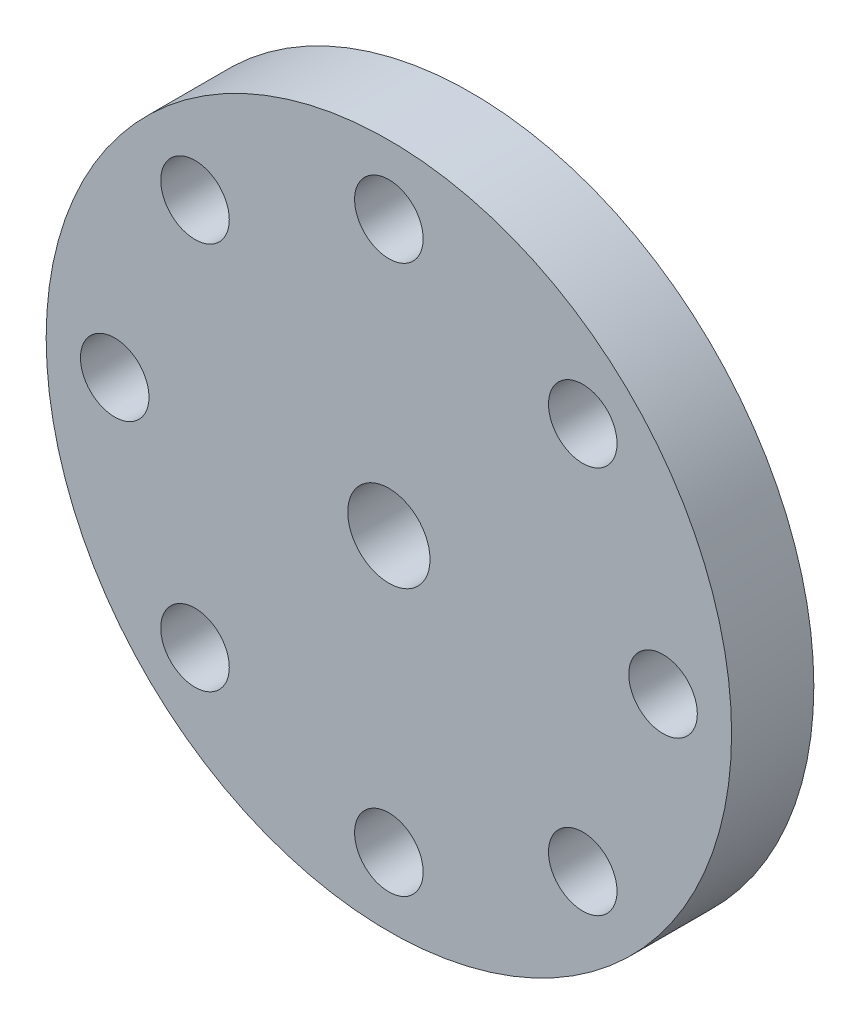
from build123d import *

# Parameters (mm, degrees)
SKETCH1_R           = 12.5
SKETCH1_R_2         = 1.25
SKETCH1_R_3         = 1.5
BOSS_EXTRUDE1_DEPTH = 3
SKETCH3_R           = 3.5
SKETCH3_R_2         = 1.5
CUT_EXTRUDE1_DEPTH  = 0.5


with BuildPart() as part:
    # Sketch1 → Boss-Extrude1 (new body)
    with BuildSketch(Plane.XY):
        Circle(SKETCH1_R)
        with Locations((0, 10)):
            Circle(SKETCH1_R_2, mode=Mode.SUBTRACT)
        Circle(SKETCH1_R_3, mode=Mode.SUBTRACT)
        with Locations((7.071067812, 7.071067812)):
            Circle(SKETCH1_R_2, mode=Mode.SUBTRACT)
        with Locations((10, 0)):
            Circle(SKETCH1_R_2, mode=Mode.SUBTRACT)
        with Locations((7.071067812, -7.071067812)):
            Circle(SKETCH1_R_2, mode=Mode.SUBTRACT)
        with Locations((0, -10)):
            Circle(SKETCH1_R_2, mode=Mode.SUBTRACT)
        with Locations((-7.071067812, -7.071067812)):
            Circle(SKETCH1_R_2, mode=Mode.SUBTRACT)
        with Locations((-10, 0)):
            Circle(SKETCH1_R_2, mode=Mode.SUBTRACT)
        with Locations((-7.071067812, 7.071067812)):
            Circle(SKETCH1_R_2, mode=Mode.SUBTRACT)
    extrude(amount=BOSS_EXTRUDE1_DEPTH)

    # Sketch3 → Cut-Extrude1 (cut)
    with BuildSketch(Plane(origin=(0, 0, 0), x_dir=(-1, 0, 0), z_dir=(0, 0, -1))):
        Circle(SKETCH3_R)
        Circle(SKETCH3_R_2, mode=Mode.SUBTRACT)
    extrude(amount=-CUT_EXTRUDE1_DEPTH, mode=Mode.SUBTRACT)


solid = part.part
